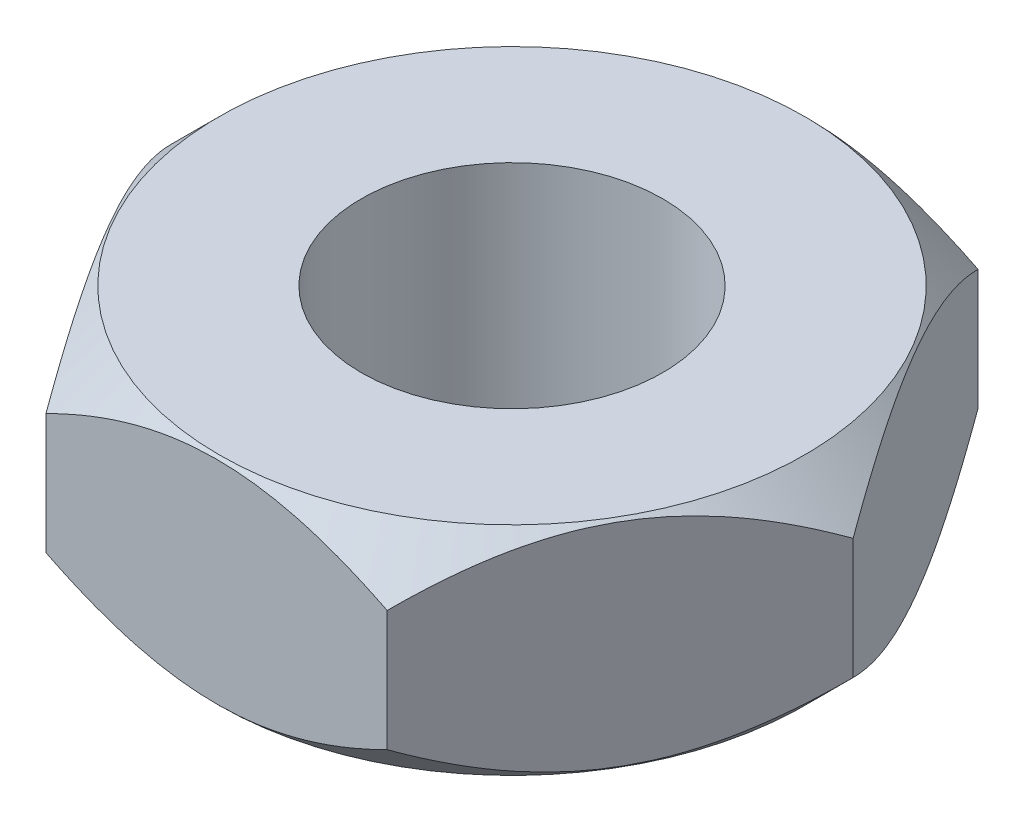
from build123d import *

# Parameters (mm, degrees)
SKETCH1_R           = 1.25
BOSS_EXTRUDE1_DEPTH = 1.8


with BuildPart() as part:
    # Sketch1 → Boss-Extrude1 (new body)
    with BuildSketch(Plane(origin=(0, 0, 0), x_dir=(1, 0, 0), z_dir=(0, 1, 0))):
        Polygon((1.41450816, 2.45), (-1.41450816, 2.45), (-2.829016319, 0), (-1.41450816, -2.45), (1.41450816, -2.45), (2.829016319, 0), align=None)
        with Locations(Location((0, 0, 0), (0, 0, 270))):
            Circle(SKETCH1_R, mode=Mode.SUBTRACT)
    extrude(amount=BOSS_EXTRUDE1_DEPTH)

    # Sketch3 → Cut-Revolve2 (revolve, cut)
    with BuildSketch(Plane(origin=(0, 0, 0), x_dir=(-1, 0, 0), z_dir=(0, 0, -1)), mode=Mode.PRIVATE) as cut_revolve2_sk:
        Polygon((-2.829016319, 1.8), (-2.829016319, 1.4), (-2.429016319, 1.8), align=None)
    cut_revolve2 = revolve(cut_revolve2_sk.sketch.rotate(Axis((0, 1.89, 0), (0, -1, 0)), 300.000000777), axis=Axis((0, 1.89, 0), (0, -1, 0)), mode=Mode.SUBTRACT)

    # Mirror1: Cut-Revolve2 across plane
    add(cut_revolve2.mirror(Plane.ZX.offset(0.9)), mode=Mode.SUBTRACT)


solid = part.part
